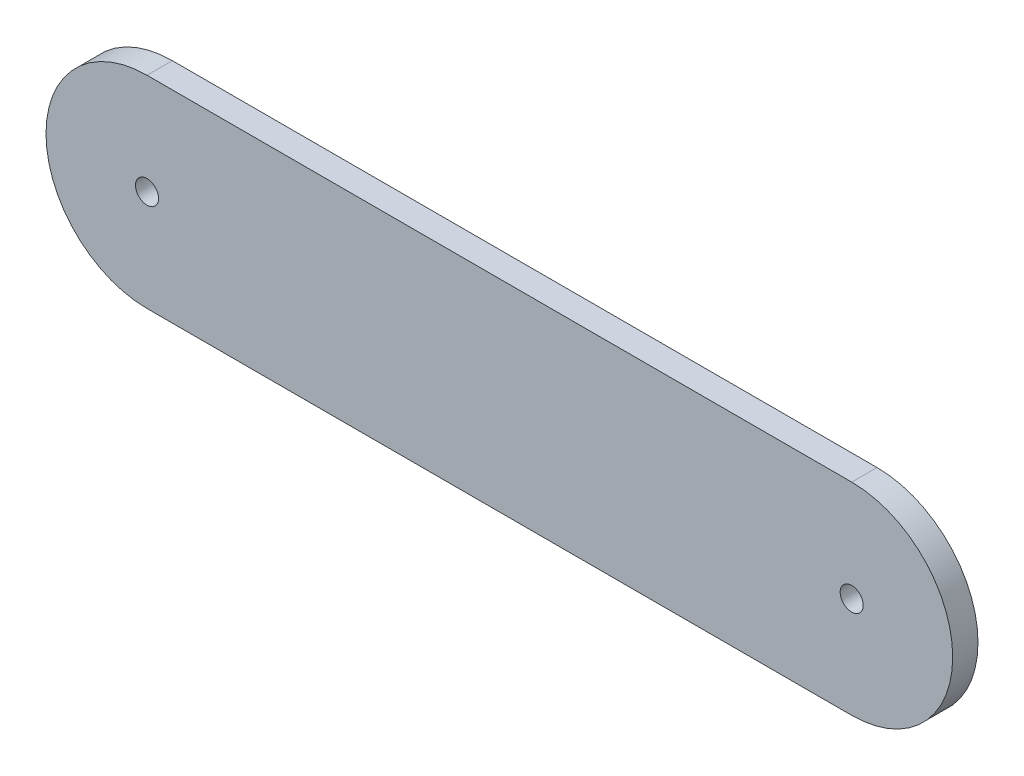
from build123d import *

# Parameters (mm, degrees)
BOSS_EXTRUDE1_DEPTH = 3.18
SKETCH3_R           = 1.45
CUT_EXTRUDE1_DEPTH  = 103.142510249


with BuildPart() as part:
    # Sketch1 → Boss-Extrude1 (new body)
    with BuildSketch(Plane.XY):
        with BuildLine():
            Line((88.6, -12.7), (0, -12.7))
            ThreePointArc((0, -12.7), (-12.7, 0), (0, 12.7))
            Line((0, 12.7), (88.6, 12.7))
            ThreePointArc((88.6, 12.7), (101.3, 0), (88.6, -12.7))
        make_face()
    extrude(amount=BOSS_EXTRUDE1_DEPTH)

    # Sketch3 → Cut-Extrude1 (cut, through all)
    with BuildSketch(Plane.XY.offset(3.18)):
        Circle(SKETCH3_R)
        with Locations((88.6, 0)):
            Circle(SKETCH3_R)
    extrude(amount=-CUT_EXTRUDE1_DEPTH, mode=Mode.SUBTRACT)


solid = part.part
